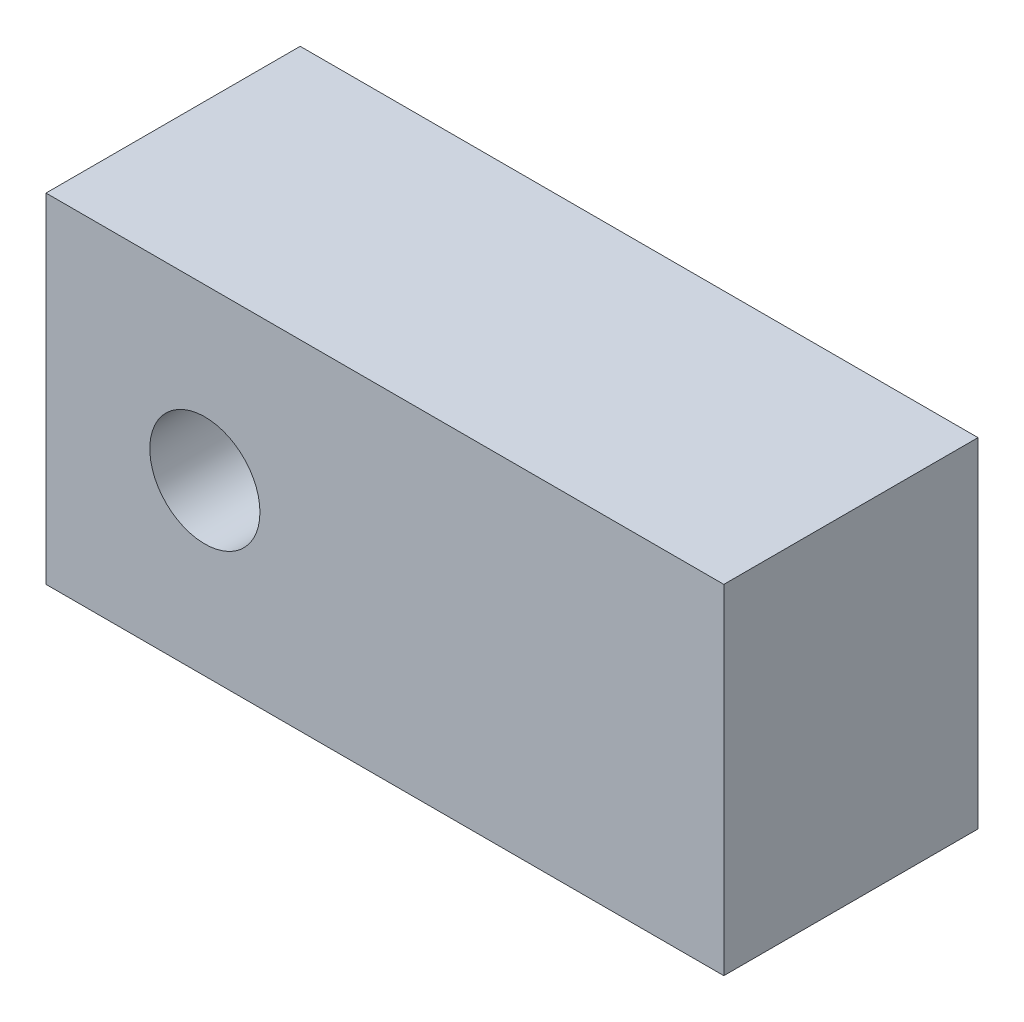
from build123d import *

# Parameters (mm, degrees)
SKETCH1_W           = 20.32
SKETCH1_H           = 10.16
BOSS_EXTRUDE1_DEPTH = 7.62
SKETCH2_R           = 1.651
CUT_EXTRUDE1_DEPTH  = 24.962312075


with BuildPart() as part:
    # Sketch1 → Boss-Extrude1 (new body)
    with BuildSketch(Plane.XY):
        with Locations((10.16, 5.08)):
            Rectangle(SKETCH1_W, SKETCH1_H)
    extrude(amount=BOSS_EXTRUDE1_DEPTH)

    # Sketch2 → Cut-Extrude1 (cut, through all)
    with BuildSketch(Plane.XY.offset(7.62)):
        with Locations((4.7625, 5.08)):
            Circle(SKETCH2_R)
    extrude(amount=-CUT_EXTRUDE1_DEPTH, mode=Mode.SUBTRACT)


solid = part.part
